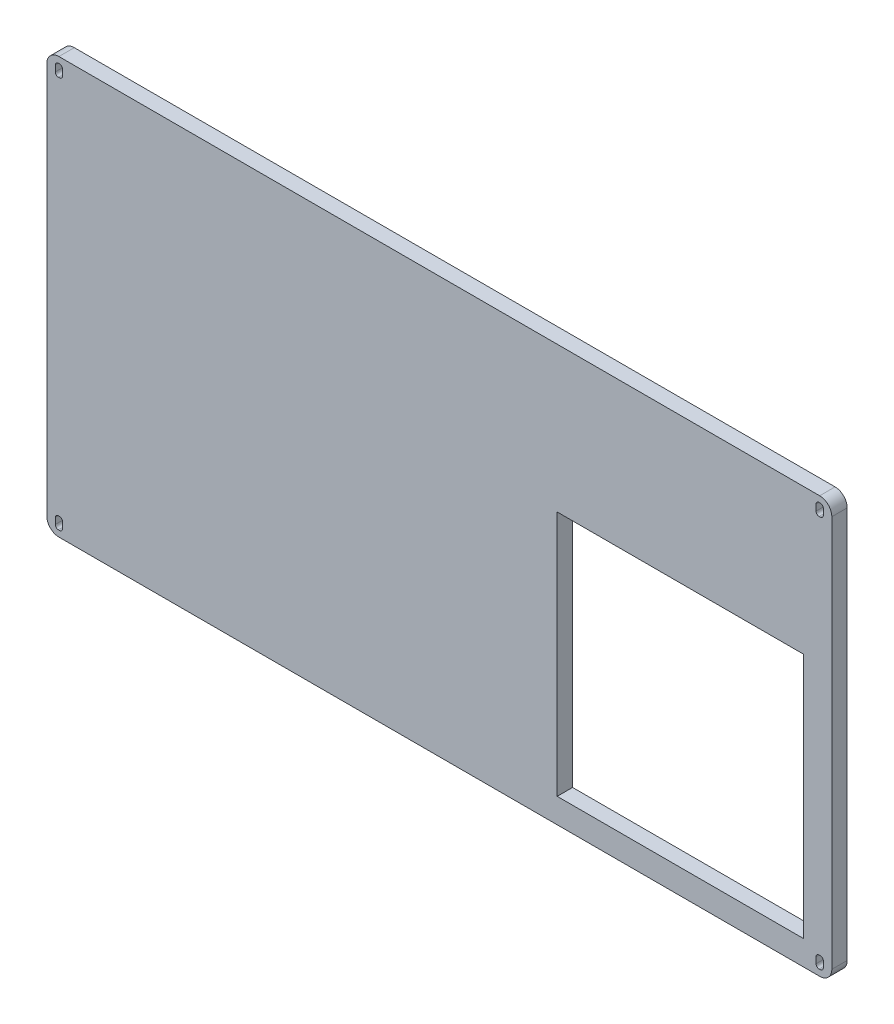
from build123d import *

# Parameters (mm, degrees)
SKETCH1_W           = 647.7
SKETCH1_H           = 343.408
SKETCH1_W_2         = 203.2
SKETCH1_H_2         = 203.2
BOSS_EXTRUDE1_DEPTH = 12.7
FILLET1_R           = 10


with BuildPart() as part:
    # Sketch1 → Boss-Extrude1 (new body)
    with BuildSketch(Plane.XY):
        with Locations((-66.978068182, 49.838840909)):
            Rectangle(SKETCH1_W, SKETCH1_H)
        with BuildLine():
            Line((247.371931818, -116.865159091), (246.371931818, -116.865159091))
            ThreePointArc((246.371931818, -116.865159091), (244.604164865, -116.132926044), (243.871931818, -114.365159091))
            Line((243.871931818, -114.365159091), (243.871931818, -109.365159091))
            ThreePointArc((243.871931818, -109.365159091), (244.604164865, -107.597392138), (246.371931818, -106.865159091))
            Line((246.371931818, -106.865159091), (247.371931818, -106.865159091))
            ThreePointArc((247.371931818, -106.865159091), (249.139698771, -107.597392138), (249.871931818, -109.365159091))
            Line((249.871931818, -109.365159091), (249.871931818, -114.365159091))
            ThreePointArc((249.871931818, -114.365159091), (249.139698771, -116.132926044), (247.371931818, -116.865159091))
        make_face(mode=Mode.SUBTRACT)
        with Locations((131.884838954, 0.072858907)):
            Rectangle(SKETCH1_W_2, SKETCH1_H_2, mode=Mode.SUBTRACT)
        with BuildLine():
            Line((-380.328068182, -116.865159091), (-381.328068182, -116.865159091))
            ThreePointArc((-381.328068182, -116.865159091), (-383.095835135, -116.132926044), (-383.828068182, -114.365159091))
            Line((-383.828068182, -114.365159091), (-383.828068182, -109.365159091))
            ThreePointArc((-383.828068182, -109.365159091), (-383.095835135, -107.597392138), (-381.328068182, -106.865159091))
            Line((-381.328068182, -106.865159091), (-380.328068182, -106.865159091))
            ThreePointArc((-380.328068182, -106.865159091), (-378.560301229, -107.597392138), (-377.828068182, -109.365159091))
            Line((-377.828068182, -109.365159091), (-377.828068182, -114.365159091))
            ThreePointArc((-377.828068182, -114.365159091), (-378.560301229, -116.132926044), (-380.328068182, -116.865159091))
        make_face(mode=Mode.SUBTRACT)
        with BuildLine():
            Line((-380.328068182, 206.544840909), (-381.328068182, 206.544840909))
            ThreePointArc((-381.328068182, 206.544840909), (-383.095835135, 207.277073956), (-383.828068182, 209.044840909))
            Line((-383.828068182, 209.044840909), (-383.828068182, 214.044840909))
            ThreePointArc((-383.828068182, 214.044840909), (-383.095835135, 215.812607862), (-381.328068182, 216.544840909))
            Line((-381.328068182, 216.544840909), (-380.328068182, 216.544840909))
            ThreePointArc((-380.328068182, 216.544840909), (-378.560301229, 215.812607862), (-377.828068182, 214.044840909))
            Line((-377.828068182, 214.044840909), (-377.828068182, 209.044840909))
            ThreePointArc((-377.828068182, 209.044840909), (-378.560301229, 207.277073956), (-380.328068182, 206.544840909))
        make_face(mode=Mode.SUBTRACT)
        with BuildLine():
            Line((247.371931818, 206.544840909), (246.371931818, 206.544840909))
            ThreePointArc((246.371931818, 206.544840909), (244.604164865, 207.277073956), (243.871931818, 209.044840909))
            Line((243.871931818, 209.044840909), (243.871931818, 214.044840909))
            ThreePointArc((243.871931818, 214.044840909), (244.604164865, 215.812607862), (246.371931818, 216.544840909))
            Line((246.371931818, 216.544840909), (247.371931818, 216.544840909))
            ThreePointArc((247.371931818, 216.544840909), (249.139698771, 215.812607862), (249.871931818, 214.044840909))
            Line((249.871931818, 214.044840909), (249.871931818, 209.044840909))
            ThreePointArc((249.871931818, 209.044840909), (249.139698771, 207.277073956), (247.371931818, 206.544840909))
        make_face(mode=Mode.SUBTRACT)
    extrude(amount=BOSS_EXTRUDE1_DEPTH)

    # Fillet1
    fillet1_edges = [part.edges().sort_by_distance(p)[0] for p in [
        (-390.828068182, 221.542840909, 6.35),
        (256.871931818, 221.542840909, 6.35),
        (256.871931818, -121.865159091, 6.35),
        (-390.828068182, -121.865159091, 6.35),
    ]]
    fillet(fillet1_edges, radius=FILLET1_R)


solid = part.part
